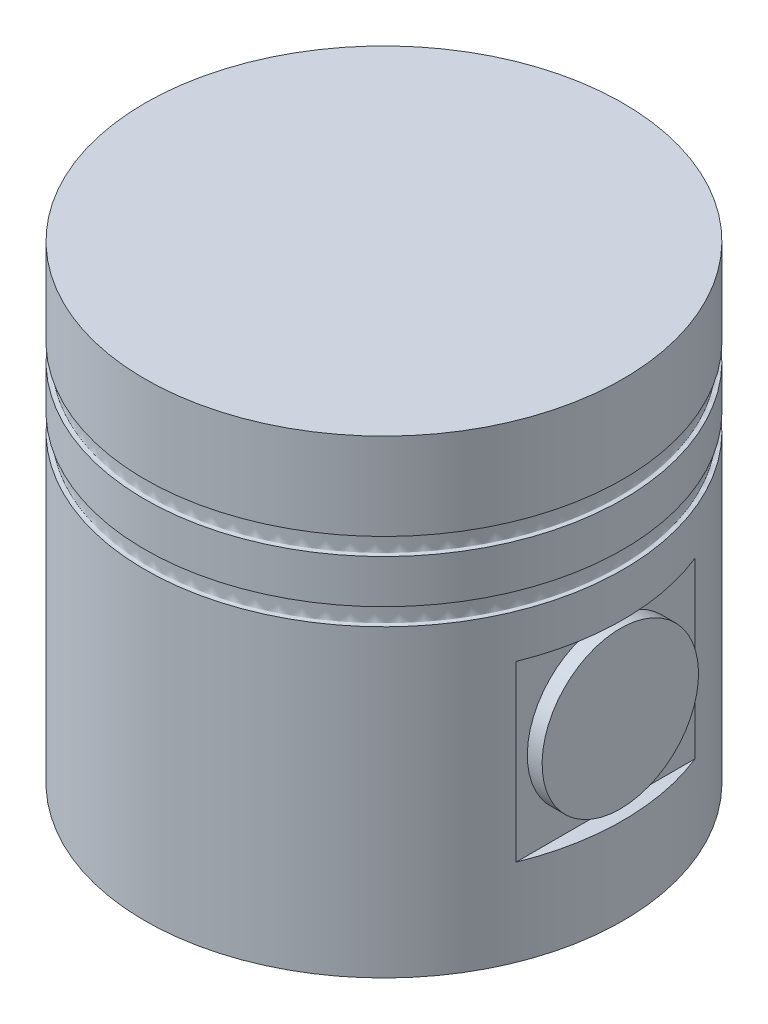
from build123d import *

# Parameters (mm, degrees)
SKETCH4_W                = 2
SKETCH4_H                = 20
CUT_EXTRUDE1_DEPTH       = 67.546975972
CUT_EXTRUDE2_REACH       = 82.506
SKETCH5_R                = 9
BOSS_EXTRUDE1_DEPTH      = 1.7
BOSS_EXTRUDE1_DEPTH_BACK = 52.7
SKETCH6_R                = 9


with BuildPart() as part:
    # Sketch2 → Revolve1 (revolve)
    with BuildSketch(Plane.XY, mode=Mode.PRIVATE) as revolve1_sk:
        with BuildLine():
            Line((27.5, 54), (0, 54))
            Line((0, 54), (0, 51.5))
            Line((0, 51.5), (25, 51.5))
            Line((25, 51.5), (25, 0))
            Line((25, 0), (27.5, 0))
            Line((27.5, 0), (27.5, 35))
            add(Edge.make_bspline(
                [(27.5, 37), (27.341501954, 37), (27.179153184, 37), (27.012953688, 37), (27, 36.987046312), (27, 36.329015437), (27, 35.670984563), (27, 35.012953688), (27.012953688, 35), (27.179153184, 35), (27.341501954, 35), (27.5, 35)],
                knots=[0, 0, 0, 0, 0.16002955, 0.163917483, 0.167805416, 0.171693349, 0.828306651, 0.832194584, 0.836082517, 0.83997045, 1, 1, 1, 1], degree=3))
            Line((27.5, 37), (27.5, 42))
            add(Edge.make_bspline(
                [(27.5, 44), (27.341501954, 44), (27.179153184, 44), (27.012953688, 44), (27, 43.987046312), (27, 43.329015437), (27, 42.670984563), (27, 42.012953688), (27.012953688, 42), (27.179153184, 42), (27.341501954, 42), (27.5, 42)],
                knots=[0, 0, 0, 0, 0.16002955, 0.163917483, 0.167805416, 0.171693349, 0.828306651, 0.832194584, 0.836082517, 0.83997045, 1, 1, 1, 1], degree=3))
            Line((27.5, 44), (27.5, 54))
        make_face()
    revolve(revolve1_sk.sketch.rotate(Axis((0, 54, 0), (0, -1, 0)), 180), axis=Axis((0, 54, 0), (0, -1, 0)))

    # Sketch4 → Cut-Extrude1 (cut, symmetric)
    with BuildSketch(Plane.XY):
        with Locations((-26.5, 20)):
            Rectangle(SKETCH4_W, SKETCH4_H)
    cut_extrude1 = extrude(amount=CUT_EXTRUDE1_DEPTH, both=True, mode=Mode.SUBTRACT)

    # Mirror1: Cut-Extrude1 across plane
    add(cut_extrude1.mirror(Plane(origin=(0, 0, 0), x_dir=(0, 0, 1), z_dir=(1, 0, 0))), mode=Mode.SUBTRACT)

    # Cut-Extrude2: up to this face of the body (flat: up to its plane)
    cut_extrude2_end = Plane(part.part.faces().sort_by_distance((25.5, 20, 0))[0])
    # Sketch5 → Cut-Extrude2 (cut, up to the picked face)
    with BuildSketch(Plane.ZY.offset(25.5), mode=Mode.PRIVATE) as cut_extrude2_sk1:
        with Locations(Location((0, 20, 0), (0, 0, 270))):
            Circle(SKETCH5_R)
    cut_extrude2_tool1 = split(extrude(cut_extrude2_sk1.sketch, amount=-CUT_EXTRUDE2_REACH, mode=Mode.PRIVATE), bisect_by=cut_extrude2_end, keep=Keep.BOTH, mode=Mode.PRIVATE)
    add(cut_extrude2_tool1.solids().sort_by(Axis((-25.5, 20, 0), (1, 0, 0)))[0], mode=Mode.SUBTRACT)


with BuildPart() as body_2:
    # Sketch6 → Boss-Extrude1 (new, two sides: drawn at the far end of the back side and taken through both)
    with BuildSketch(Plane.ZY.offset(25.5).offset(-BOSS_EXTRUDE1_DEPTH_BACK)):
        with Locations(Location((0, 20, 0), (0, 0, 270))):
            Circle(SKETCH6_R)
    extrude(amount=BOSS_EXTRUDE1_DEPTH + BOSS_EXTRUDE1_DEPTH_BACK)


solid = Compound([part.part, body_2.part])
